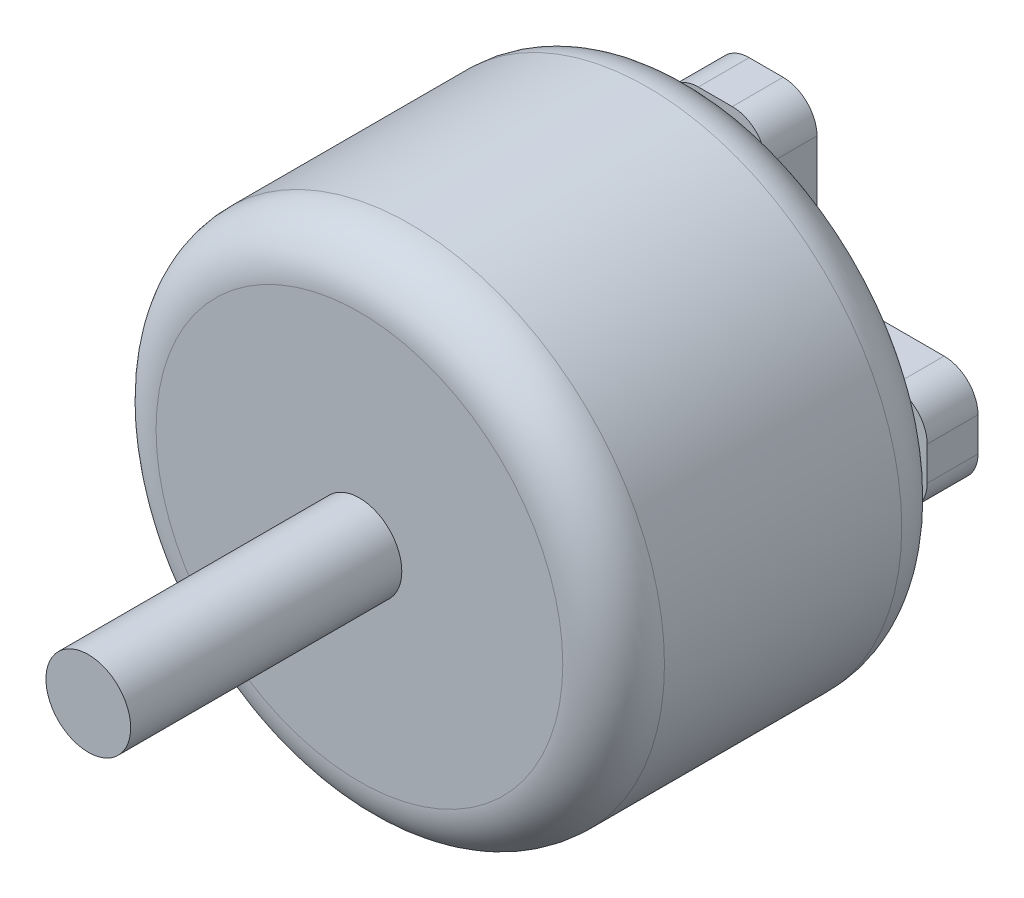
from build123d import *

# Parameters (mm, degrees)
SKETCH1_R           = 1.6
BOSS_EXTRUDE1_DEPTH = 3
SKETCH2_R           = 2.852011264
BOSS_EXTRUDE2_DEPTH = 1
SKETCH3_R           = 15
BOSS_EXTRUDE3_DEPTH = 20
SKETCH4_R           = 2.5
BOSS_EXTRUDE4_DEPTH = 16
FILLET1_R           = 3


with BuildPart() as part:
    # Sketch1 → Boss-Extrude1 (new body)
    with BuildSketch(Plane.XY):
        with BuildLine():
            Line((-71.781745931, -74.781745931), (-67.281745931, -74.781745931))
            ThreePointArc((-67.281745931, -74.781745931), (-65.867532368, -75.367532368), (-65.281745931, -76.781745931))
            Line((-65.281745931, -76.781745931), (-65.281745931, -78.781745931))
            ThreePointArc((-65.281745931, -78.781745931), (-65.867532368, -80.195959493), (-67.281745931, -80.781745931))
            Line((-67.281745931, -80.781745931), (-71.781745931, -80.781745931))
            ThreePointArc((-71.781745931, -80.781745931), (-73.903066274, -81.660425587), (-74.781745931, -83.781745931))
            Line((-74.781745931, -83.781745931), (-74.781745931, -88.281745931))
            ThreePointArc((-74.781745931, -88.281745931), (-75.367532368, -89.695959493), (-76.781745931, -90.281745931))
            Line((-76.781745931, -90.281745931), (-78.781745931, -90.281745931))
            ThreePointArc((-78.781745931, -90.281745931), (-80.195959493, -89.695959493), (-80.781745931, -88.281745931))
            Line((-80.781745931, -88.281745931), (-80.781745931, -83.781745931))
            ThreePointArc((-80.781745931, -83.781745931), (-81.660425587, -81.660425587), (-83.781745931, -80.781745931))
            Line((-83.781745931, -80.781745931), (-88.281745931, -80.781745931))
            ThreePointArc((-88.281745931, -80.781745931), (-89.695959493, -80.195959493), (-90.281745931, -78.781745931))
            Line((-90.281745931, -78.781745931), (-90.281745931, -76.781745931))
            ThreePointArc((-90.281745931, -76.781745931), (-89.695959493, -75.367532368), (-88.281745931, -74.781745931))
            Line((-88.281745931, -74.781745931), (-83.781745931, -74.781745931))
            ThreePointArc((-83.781745931, -74.781745931), (-81.660425587, -73.903066274), (-80.781745931, -71.781745931))
            Line((-80.781745931, -71.781745931), (-80.781745931, -67.281745931))
            ThreePointArc((-80.781745931, -67.281745931), (-80.195959493, -65.867532368), (-78.781745931, -65.281745931))
            Line((-78.781745931, -65.281745931), (-76.781745931, -65.281745931))
            ThreePointArc((-76.781745931, -65.281745931), (-75.367532368, -65.867532368), (-74.781745931, -67.281745931))
            Line((-74.781745931, -67.281745931), (-74.781745931, -71.781745931))
            ThreePointArc((-74.781745931, -71.781745931), (-73.903066274, -73.903066274), (-71.781745931, -74.781745931))
        make_face()
        with Locations((-77.781745931, -68.281745931)):
            Circle(SKETCH1_R, mode=Mode.SUBTRACT)
        with Locations((-68.281745931, -77.781745931)):
            Circle(SKETCH1_R, mode=Mode.SUBTRACT)
        with Locations((-77.781745931, -87.281745931)):
            Circle(SKETCH1_R, mode=Mode.SUBTRACT)
        with Locations((-87.281745931, -77.781745931)):
            Circle(SKETCH1_R, mode=Mode.SUBTRACT)
    extrude(amount=BOSS_EXTRUDE1_DEPTH)

    # Sketch2 → Boss-Extrude2 (add)
    with BuildSketch(Plane.XY.offset(3)):
        with Locations((-77.781745931, -77.781745931)):
            Circle(SKETCH2_R)
    extrude(amount=BOSS_EXTRUDE2_DEPTH)

    # Sketch3 → Boss-Extrude3 (add)
    with BuildSketch(Plane.XY.offset(4)):
        with Locations((-77.781745931, -77.781745931)):
            Circle(SKETCH3_R)
    extrude(amount=BOSS_EXTRUDE3_DEPTH)

    # Sketch4 → Boss-Extrude4 (add)
    with BuildSketch(Plane.XY.offset(24)):
        with Locations((-77.781745931, -77.781745931)):
            Circle(SKETCH4_R)
    extrude(amount=BOSS_EXTRUDE4_DEPTH)

    # Fillet1
    fillet1_edges = [part.edges().sort_by_distance(p)[0] for p in [
        (-92.781745931, -77.781745931, 4),
        (-92.781745931, -77.781745931, 24),
    ]]
    fillet(fillet1_edges, radius=FILLET1_R)


solid = part.part
